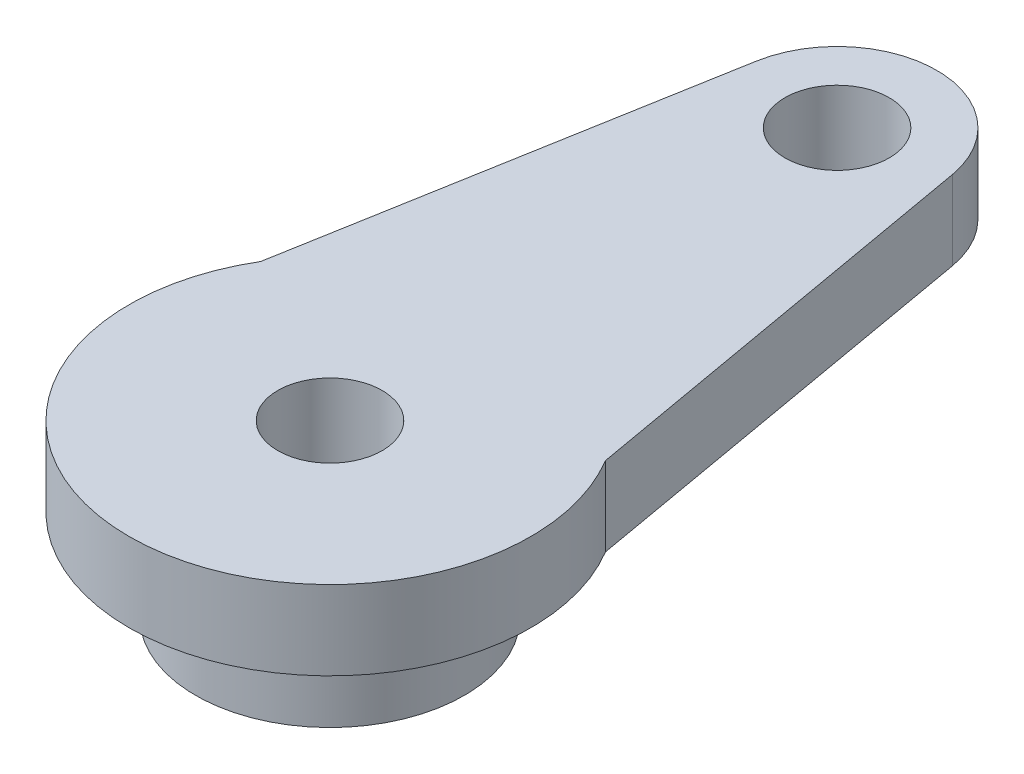
from build123d import *

# Parameters (mm, degrees)
BASES_R             = 6.35
BASE_DEPTH          = 5.4
TOPBORES_R          = 1.65
TOP_BORE_DEPTH      = 11.478788098
HORN_START          = -2.5
HORN_HALF_DEPTH     = 2.5
HORNATTACHS_R       = 1.65
HORN_ATTACH_DEPTH   = 21.913031822
HOLDINGSHAFTS_R     = 6.35
HOLDINGSHAFTS_R_2   = 4.25
HOLDING_SHAFT_DEPTH = 2.9
SKETCH3_R           = 3.025
CUT_EXTRUDE2_DEPTH  = 2.9


with BuildPart() as part:
    # BaseS → BASE (new body)
    with BuildSketch(Plane(origin=(0, 0, 0), x_dir=(1, 0, 0), z_dir=(0, 1, 0))):
        with Locations(Location((0, 0, 0), (0, 0, 90))):
            Circle(BASES_R)
    extrude(amount=BASE_DEPTH)

    # TopBoreS → TOP BORE (cut, through all)
    with BuildSketch(Plane(origin=(0, 5.4, 0), x_dir=(1, 0, 0), z_dir=(0, 1, 0))):
        with Locations(Location((0, 0, 0), (0, 0, 270))):
            Circle(TOPBORES_R)
    extrude(amount=-TOP_BORE_DEPTH, mode=Mode.SUBTRACT)

    # HornHalfS → HORN HALF (add)
    with BuildSketch(Plane(origin=(0, 5.4, 0), x_dir=(1, 0, 0), z_dir=(0, 1, 0)).offset(HORN_START)):
        with BuildLine():
            Line((-3.102144422, 16.57699176), (-5.450702003, 3.257659846))
            ThreePointArc((-5.450702003, 3.257659846), (0, 6.35), (5.450702003, 3.257659846))
            Line((5.450702003, 3.257659846), (3.102144422, 16.57699176))
            ThreePointArc((3.102144422, 16.57699176), (0, 19.18), (-3.102144422, 16.57699176))
        make_face()
    extrude(amount=HORN_HALF_DEPTH)

    # HornAttachS → HORN ATTACH (cut, through all)
    with BuildSketch(Plane(origin=(0, 5.4, 0), x_dir=(1, 0, 0), z_dir=(0, 1, 0))):
        with Locations(Location((0, 16.03, 0), (0, 0, 270))):
            Circle(HORNATTACHS_R)
    extrude(amount=-HORN_ATTACH_DEPTH, mode=Mode.SUBTRACT)

    # HoldingShaftS → HOLDING SHAFT (cut)
    with BuildSketch(Plane.XZ):
        Circle(HOLDINGSHAFTS_R)
        with Locations(Location((0, 0, 0), (0, 0, 270))):
            Circle(HOLDINGSHAFTS_R_2, mode=Mode.SUBTRACT)
    extrude(amount=-HOLDING_SHAFT_DEPTH, mode=Mode.SUBTRACT)

    # Sketch3 → Cut-Extrude2 (cut)
    with BuildSketch(Plane.XZ):
        with Locations(Location((0, 0, 0), (0, 0, 270))):
            Circle(SKETCH3_R)
    extrude(amount=-CUT_EXTRUDE2_DEPTH, mode=Mode.SUBTRACT)


solid = part.part
